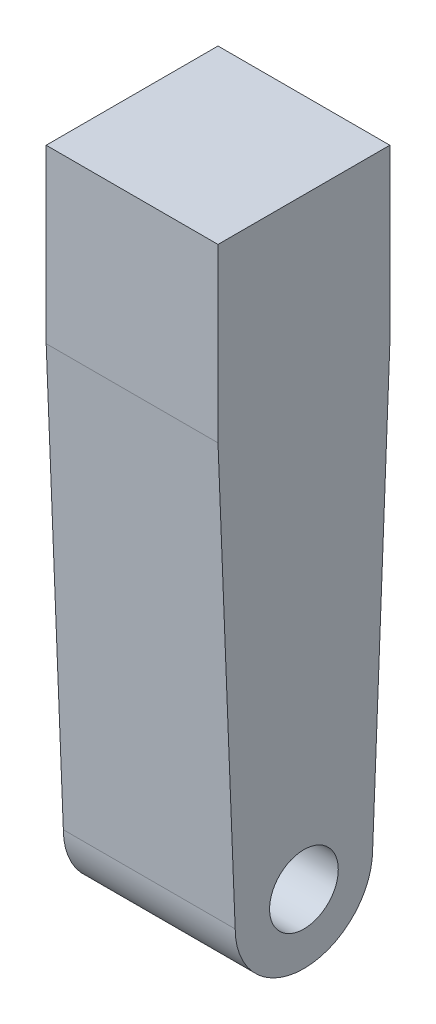
from build123d import *

# Parameters (mm, degrees)
CROQUIS1_R              = 0.5
SALIENTE_EXTRUIR1_DEPTH = 2.5


with BuildPart() as part:
    # Croquis1 → Saliente-Extruir1 (new body)
    with BuildSketch(Plane(origin=(0, 0, 0), x_dir=(0, 0, -1), z_dir=(1, 0, 0))):
        with BuildLine():
            Line((1.25, 1.25), (-1.25, 1.25))
            Line((-1.25, 1.25), (-1.25, -1.25))
            Line((-1.25, -1.25), (-1, -7.5))
            ThreePointArc((-1, -7.5), (0, -8.5), (1, -7.5))
            Line((1, -7.5), (1.25, -1.25))
            Line((1.25, -1.25), (1.25, 1.25))
        make_face()
        with Locations((0, -7.5)):
            Circle(CROQUIS1_R, mode=Mode.SUBTRACT)
    extrude(amount=SALIENTE_EXTRUIR1_DEPTH)


solid = part.part
